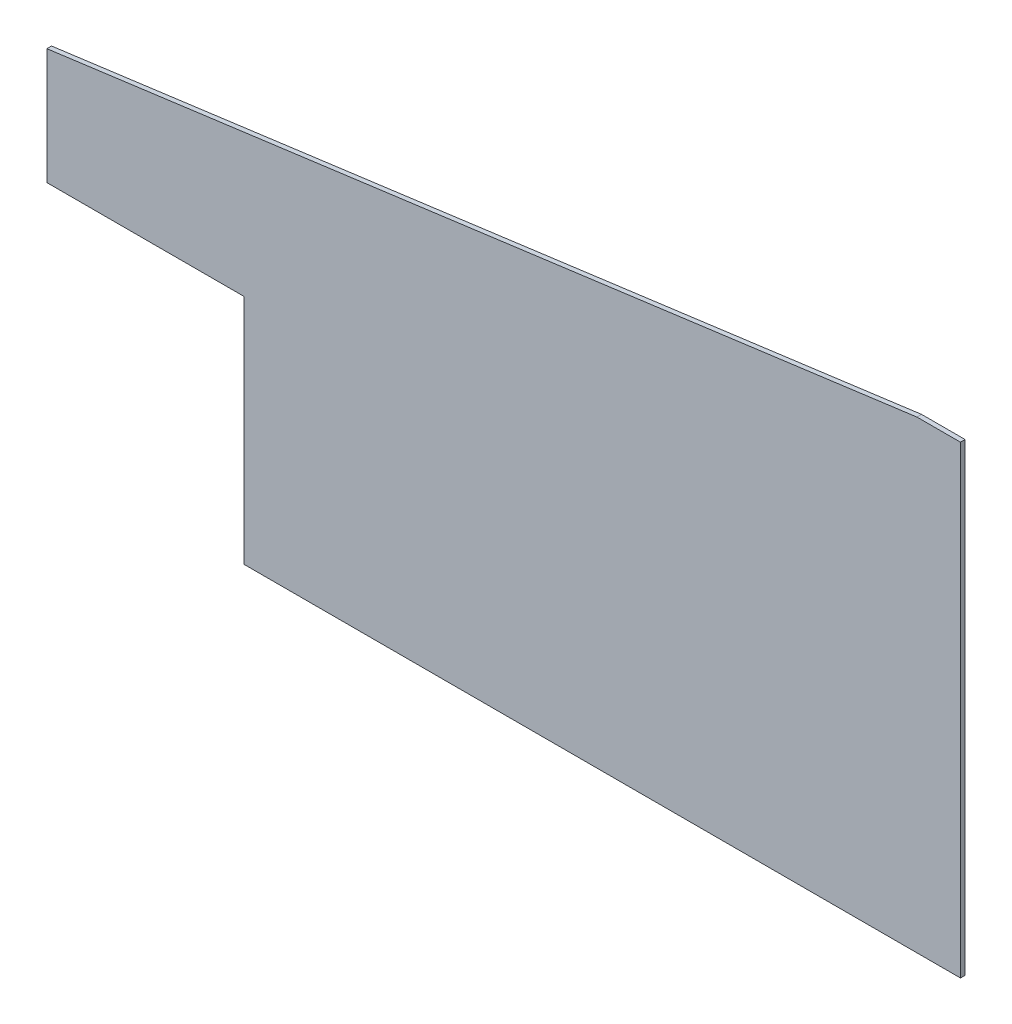
from build123d import *

# Parameters (mm, degrees)
BOSS_EXTRUDE1_DEPTH = 4


with BuildPart() as part:
    # Sketch1 → Boss-Extrude1 (new body)
    with BuildSketch(Plane.XY):
        Polygon((-787.5, -100), (-787.5, -200), (-617.5, -200), (-617.5, -400), (0, -400), (0, 0), (-37.5, 0), align=None)
    extrude(amount=BOSS_EXTRUDE1_DEPTH)


solid = part.part
